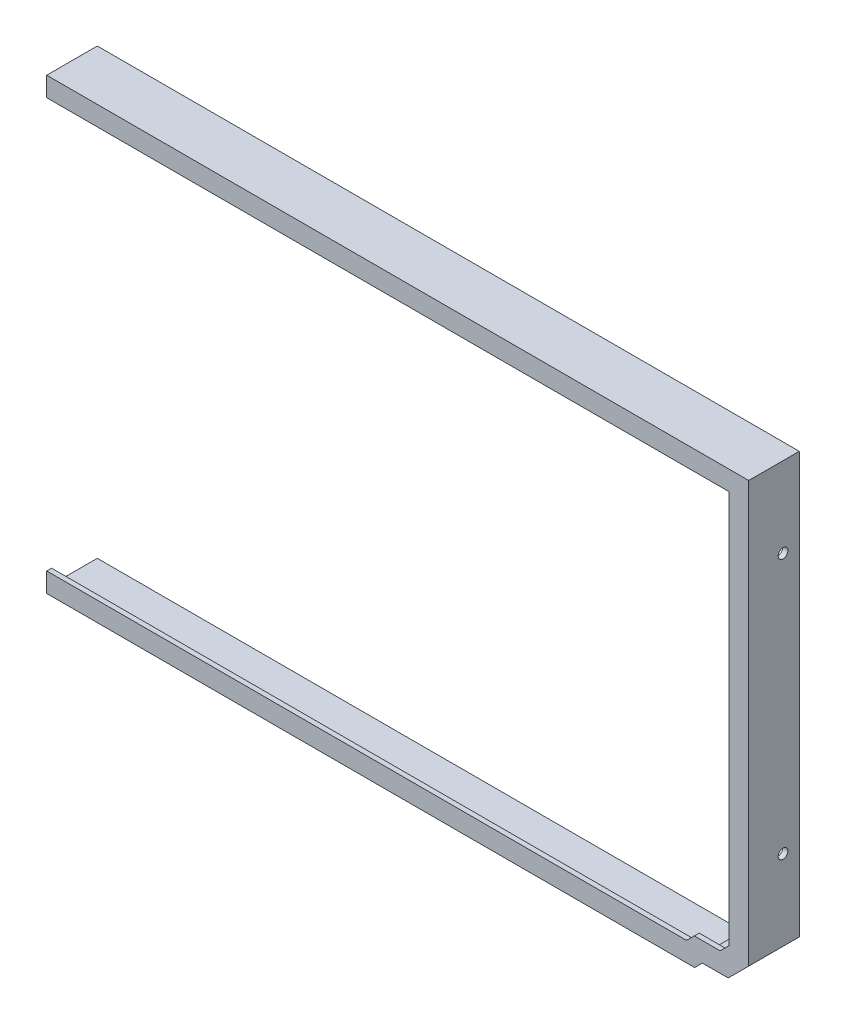
from build123d import *

# Parameters (mm, degrees)
P_IDAT_VYSUNUT_M1_DEPTH  = 14.05
P_IDAT_VYSUNUT_M2_DEPTH  = 1.5
ODEBRAT_VYSUNUT_M1_DEPTH = 1.6
ODEBRAT_VYSUNUT_M2_REACH = 454.909
SKICA4_R                 = 1.5
SKICA5_W                 = 215.84
SKICA5_H                 = 15.55
ODEBRAT_VYSUNUT_M3_DEPTH = 452.805134863


with BuildPart() as part:
    # Skica1 → Přidat vysunutím1 (new body)
    with BuildSketch(Plane.XY):
        Polygon((-1.7, 1.7), (429.98, 1.7), (429.98, -127.624163056), (423.673791129, -133.930371927), (415.733791129, -133.930371927), (413.350841277, -136.313321779), (14.929158723, -136.313321779), (12.546208871, -133.930371927), (4.606208871, -133.930371927), (-1.7, -127.624163056), align=None)
        Polygon((-0.1, 0.1), (428.38, 0.1), (428.38, -126.961421356), (423.01104943, -132.330371927), (415.07104943, -132.330371927), (412.688099577, -134.713321779), (15.591900423, -134.713321779), (13.20895057, -132.330371927), (5.26895057, -132.330371927), (-0.1, -126.961421356), align=None, mode=Mode.SUBTRACT)
    extrude(amount=-P_IDAT_VYSUNUT_M1_DEPTH)

    # Skica2 → Přidat vysunutím2 (add)
    with BuildSketch(Plane.XY):
        Polygon((-1.7, 1.7), (-1.7, -127.624163056), (4.606208871, -133.930371927), (12.546208871, -133.930371927), (14.929158723, -136.313321779), (413.350841277, -136.313321779), (415.733791129, -133.930371927), (423.673791129, -133.930371927), (429.98, -127.624163056), (429.98, 1.7), align=None)
        Polygon((4.3, -4.3), (4.3, -125.138881682), (7.091490245, -127.930371927), (15.031490245, -127.930371927), (17.414440098, -130.313321779), (410.865559902, -130.313321779), (413.248509755, -127.930371927), (421.188509755, -127.930371927), (423.98, -125.138881682), (423.98, -4.3), align=None, mode=Mode.SUBTRACT)
    extrude(amount=P_IDAT_VYSUNUT_M2_DEPTH)

    # Skica3 → Odebrat vysunutím1 (cut)
    with BuildSketch(Plane(origin=(0, 1.7, 0), x_dir=(1, 0, 0), z_dir=(0, 1, 0))):
        with BuildLine():
            Line((45.76, 4.75), (40.26, 4.75))
            ThreePointArc((40.26, 4.75), (36.76, 8.25), (40.26, 11.75))
            Line((40.26, 11.75), (45.76, 11.75))
            ThreePointArc((45.76, 11.75), (49.26, 8.25), (45.76, 4.75))
        make_face()
    extrude(amount=-ODEBRAT_VYSUNUT_M1_DEPTH, mode=Mode.SUBTRACT)

    # Odebrat vysunutím2: up to this face of the body (flat: up to its plane)
    odebrat_vysunut_m2_end = Plane(part.part.faces().sort_by_distance((429.98, -62.962081528, -6.275))[0])
    # Skica4 → Odebrat vysunutím2 (cut, up to the picked face)
    with BuildSketch(Plane.ZY.offset(1.7), mode=Mode.PRIVATE) as odebrat_vysunut_m2_sk1:
        with Locations(Location((-9.05, -22.962081528, 0), (0, 0, 180))):
            Circle(SKICA4_R)
    odebrat_vysunut_m2_tool1 = split(extrude(odebrat_vysunut_m2_sk1.sketch, amount=-ODEBRAT_VYSUNUT_M2_REACH, mode=Mode.PRIVATE), bisect_by=odebrat_vysunut_m2_end, keep=Keep.BOTH, mode=Mode.PRIVATE)
    # Skica4 → Odebrat vysunutím2 (cut, up to the picked face)
    with BuildSketch(Plane.ZY.offset(1.7), mode=Mode.PRIVATE) as odebrat_vysunut_m2_sk2:
        with Locations(Location((-9.05, -102.962081528, 0), (0, 0, 180))):
            Circle(SKICA4_R)
    odebrat_vysunut_m2_tool2 = split(extrude(odebrat_vysunut_m2_sk2.sketch, amount=-ODEBRAT_VYSUNUT_M2_REACH, mode=Mode.PRIVATE), bisect_by=odebrat_vysunut_m2_end, keep=Keep.BOTH, mode=Mode.PRIVATE)
    add(odebrat_vysunut_m2_tool1.solids().sort_by(Axis((-1.7, -22.962082, -9.05), (1, 0, 0)))[0], mode=Mode.SUBTRACT)
    add(odebrat_vysunut_m2_tool2.solids().sort_by(Axis((-1.7, -102.962082, -9.05), (1, 0, 0)))[0], mode=Mode.SUBTRACT)

    # Skica5 → Odebrat vysunutím3 (cut, through all)
    with BuildSketch(Plane(origin=(0, 1.7, 0), x_dir=(1, 0, 0), z_dir=(0, 1, 0))):
        with Locations((106.22, 6.275)):
            Rectangle(SKICA5_W, SKICA5_H)
    extrude(amount=-ODEBRAT_VYSUNUT_M3_DEPTH, mode=Mode.SUBTRACT)


solid = part.part
